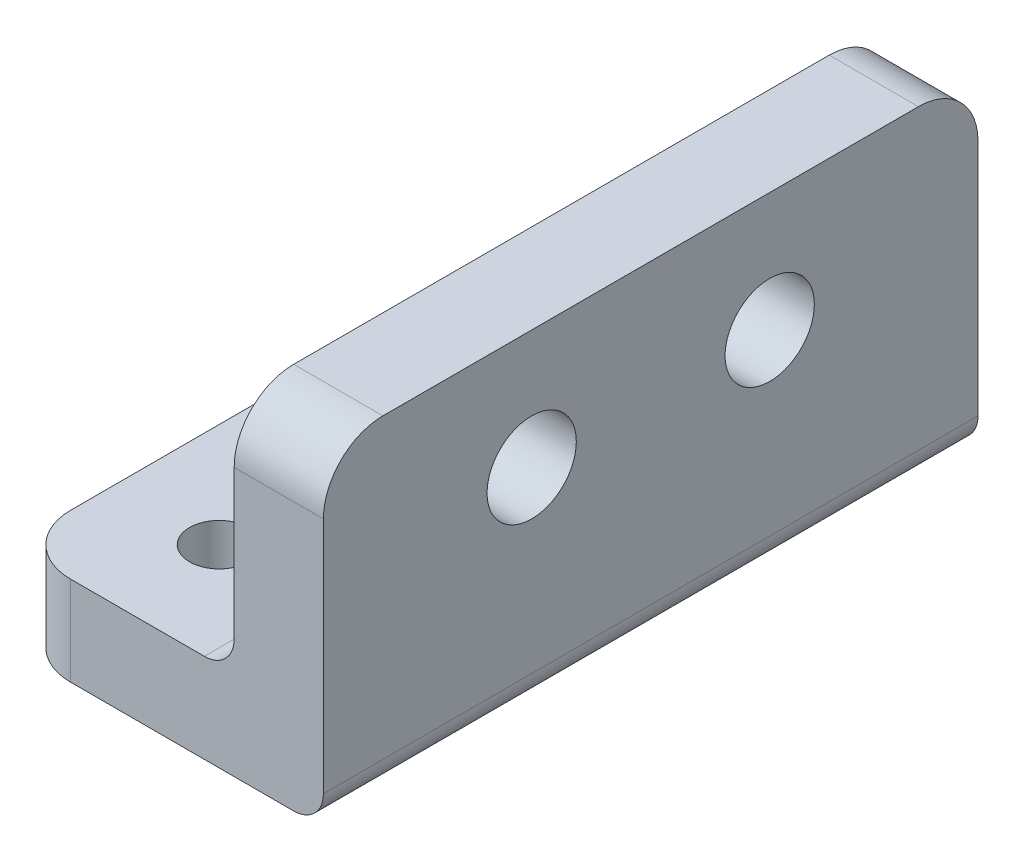
from build123d import *

# Parameters (mm, degrees)
SKETCH_1_W          = 7
SKETCH_1_H          = 22
SKETCH_1_R          = 1
SKETCH_1_W_2        = 3.5
EXTRUDE_1_DEPTH     = 3
SKETCH_2_W          = 3
SKETCH_2_H          = 22
EXTRUDE_2_DEPTH     = 8
SKETCH_3_R          = 1.5
CUT_EXTRUDE_1_DEPTH = 8
FILLET_1_R          = 2
FILLET_2_R          = 1


with BuildPart() as part:
    # 草图1 → 凸台-拉伸1 (new body)
    # profile 1 of 2: a face of its own
    with BuildSketch(Plane(origin=(0, 0, 0), x_dir=(1, 0, 0), z_dir=(0, 1, 0))):
        Rectangle(SKETCH_1_W, SKETCH_1_H)
        with Locations(Location((0, 7.5, 0), (0, 0, 270))):
            Circle(SKETCH_1_R, mode=Mode.SUBTRACT)
        with Locations(Location((0, -7.5, 0), (0, 0, 270))):
            Circle(SKETCH_1_R, mode=Mode.SUBTRACT)
    # profile 2 of 2: a face of its own
    with BuildSketch(Plane(origin=(0, 0, 0), x_dir=(1, 0, 0), z_dir=(0, 1, 0))):
        with Locations((5.25, 0)):
            Rectangle(SKETCH_1_W_2, SKETCH_1_H)
    extrude(amount=EXTRUDE_1_DEPTH)

    # 草图2 → 凸台-拉伸2 (add)
    with BuildSketch(Plane(origin=(0, 3, 0), x_dir=(1, 0, 0), z_dir=(0, 1, 0))):
        with Locations((5.5, 0)):
            Rectangle(SKETCH_2_W, SKETCH_2_H)
    extrude(amount=EXTRUDE_2_DEPTH)

    # 草图3 → 切除-拉伸1 (cut)
    with BuildSketch(Plane.ZY.offset(-4)):
        with Locations((4, 7)):
            Circle(SKETCH_3_R)
        with Locations(Location((-4, 7, 0), (0, 0, 180))):
            Circle(SKETCH_3_R)
    extrude(amount=-CUT_EXTRUDE_1_DEPTH, mode=Mode.SUBTRACT)

    # 圆角1
    fillet_1_edges = [part.edges().sort_by_distance(p)[0] for p in [
        (-3.5, 1.5, 11),
        (-3.5, 1.5, -11),
        (5.5, 11, -11),
        (5.5, 11, 11),
    ]]
    fillet(fillet_1_edges, radius=FILLET_1_R)

    # 圆角2
    fillet_2_edges = [part.edges().sort_by_distance(p)[0] for p in [
        (7, 0, 0),
        (4, 3, 0),
    ]]
    fillet(fillet_2_edges, radius=FILLET_2_R)


solid = part.part
